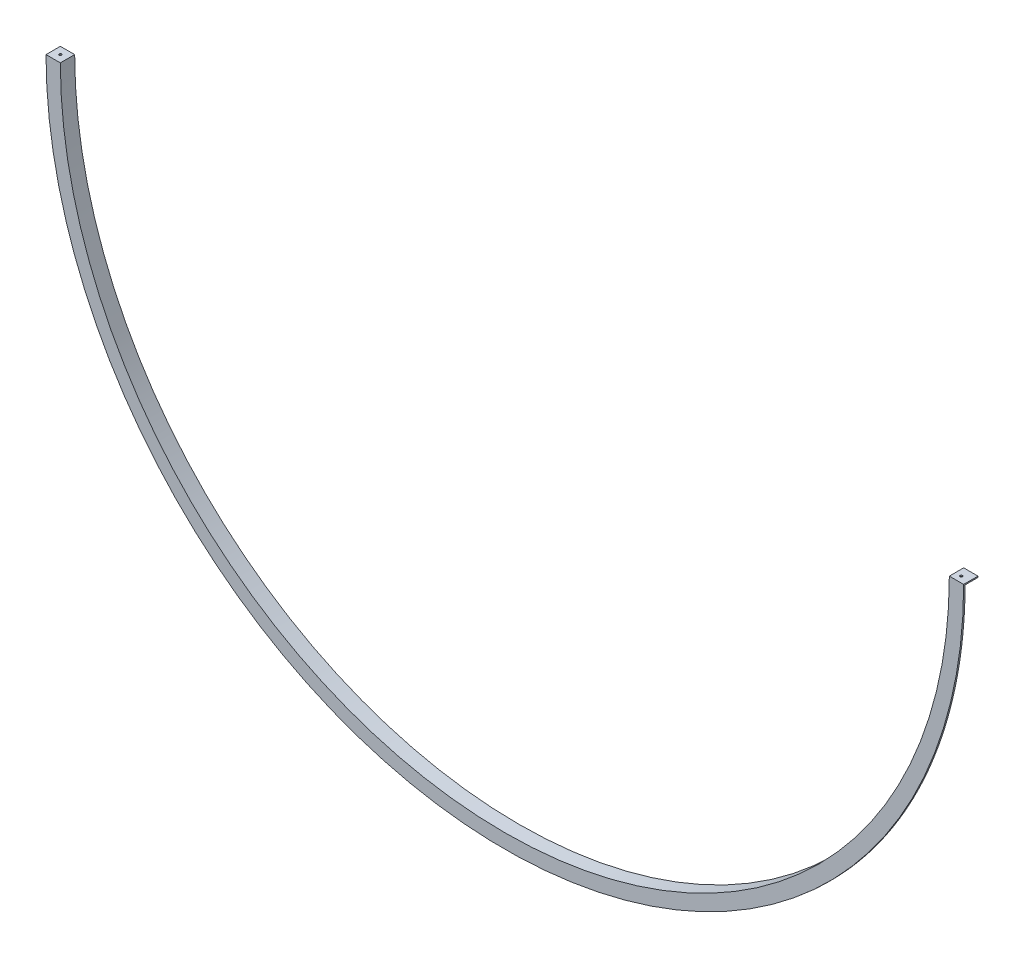
from build123d import *

# Parameters (mm, degrees)
REVOLVE1_ANGLE      = 180
SKETCH4_W           = 48.064516129
SKETCH4_H           = 48.064516129
SKETCH4_R           = 4
SKETCH4_W_2         = 48
SKETCH4_H_2         = 48
BOSS_EXTRUDE1_DEPTH = 4


with BuildPart() as part:
    # Sketch1 → Revolve1 (revolve)
    with BuildSketch(Plane(origin=(0, 0, 0), x_dir=(1, 0, 0), z_dir=(0, 1, 0))):
        Polygon((0, 0), (48.064516129, 0), (48.064516129, 4.806451613), (4.806451613, 4.806451613), (4.806451613, 48.064516129), (0, 48.064516129), align=None)
    revolve(axis=Axis((-1490, 0, 0), (0, 0, -1)), revolution_arc=REVOLVE1_ANGLE)

    # Sketch4 → Boss-Extrude1 (add)
    # profile 1 of 2: a face of its own
    with BuildSketch(Plane(origin=(0, 0, 0), x_dir=(1, 0, 0), z_dir=(0, 1, 0))):
        with Locations((24.032258065, 24.032258065)):
            Rectangle(SKETCH4_W, SKETCH4_H)
        with Locations(Location((20, 20, 0), (0, 0, 180))):
            Circle(SKETCH4_R, mode=Mode.SUBTRACT)
    # profile 2 of 2: a face of its own
    with BuildSketch(Plane(origin=(0, 0, 0), x_dir=(1, 0, 0), z_dir=(0, 1, 0))):
        with Locations((-3004, 24)):
            Rectangle(SKETCH4_W_2, SKETCH4_H_2)
        with Locations(Location((-3004, 24.032258065, 0), (0, 0, 180))):
            Circle(SKETCH4_R, mode=Mode.SUBTRACT)
    extrude(amount=-BOSS_EXTRUDE1_DEPTH)


solid = part.part
